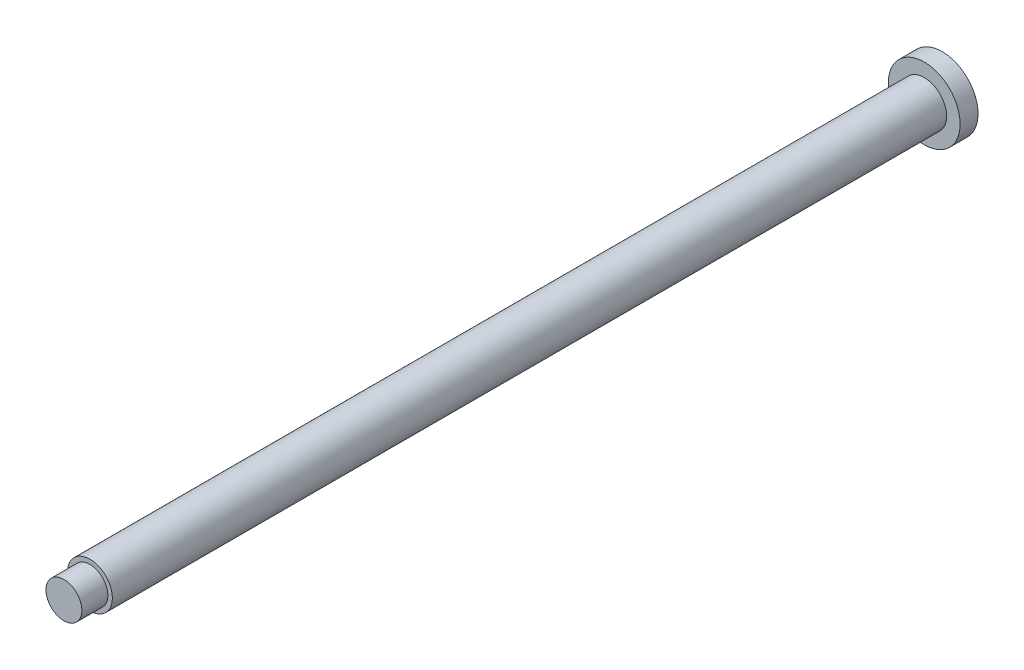
from build123d import *

# Parameters (mm, degrees)
SKETCH1_R           = 2.5
BOSS_EXTRUDE1_DEPTH = 93
SKETCH2_R           = 4
BOSS_EXTRUDE2_DEPTH = 2
SKETCH3_R           = 2.05
CUT_EXTRUDE1_DEPTH  = 3
SKETCH4_R           = 2
BOSS_EXTRUDE3_DEPTH = 2.9


with BuildPart() as part:
    # Sketch1 → Boss-Extrude1 (new body)
    with BuildSketch(Plane(origin=(0, 0, 0), x_dir=(0, 1, 0), z_dir=(0, 0, 1))):
        with Locations(Location((0, 0, 0), (0, 0, 90))):
            Circle(SKETCH1_R)
    extrude(amount=BOSS_EXTRUDE1_DEPTH)

    # Sketch2 → Boss-Extrude2 (add)
    with BuildSketch(Plane(origin=(0, 0, 0), x_dir=(1, 0, 0), z_dir=(0, 0, -1))):
        with Locations(Location((0, 0, 0), (0, 0, 180))):
            Circle(SKETCH2_R)
    extrude(amount=BOSS_EXTRUDE2_DEPTH)

    # Sketch3 → Cut-Extrude1 (cut)
    with BuildSketch(Plane(origin=(0, 0, -2), x_dir=(1, 0, 0), z_dir=(0, 0, -1))):
        with Locations(Location((0, 0, 0), (0, 0, 180))):
            Circle(SKETCH3_R)
    extrude(amount=-CUT_EXTRUDE1_DEPTH, mode=Mode.SUBTRACT)

    # Sketch4 → Boss-Extrude3 (add)
    with BuildSketch(Plane.XY.offset(93)):
        Circle(SKETCH4_R)
    extrude(amount=BOSS_EXTRUDE3_DEPTH)


solid = part.part
